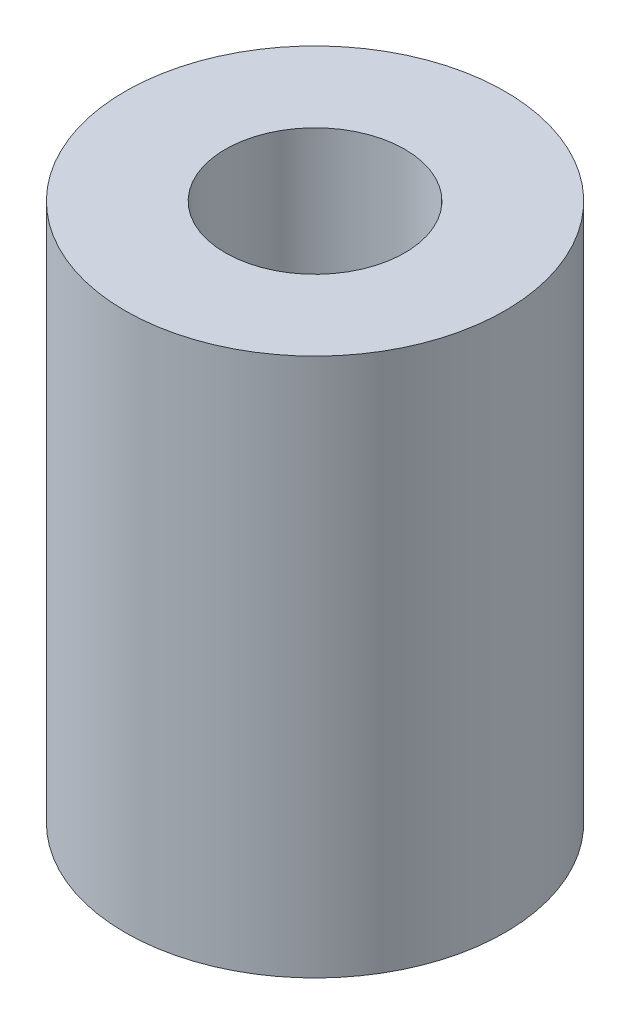
from build123d import *

# Parameters (mm, degrees)
SKETCH1_R           = 6.35
SKETCH1_R_2         = 3
BOSS_EXTRUDE1_DEPTH = 18


with BuildPart() as part:
    # Sketch1 → Boss-Extrude1 (new body)
    with BuildSketch(Plane(origin=(0, 0, 0), x_dir=(1, 0, 0), z_dir=(0, 1, 0))):
        with Locations(Location((0, 0, 0), (0, 0, 270))):
            Circle(SKETCH1_R)
        with Locations(Location((0, 0, 0), (0, 0, 270))):
            Circle(SKETCH1_R_2, mode=Mode.SUBTRACT)
    extrude(amount=BOSS_EXTRUDE1_DEPTH)


solid = part.part
